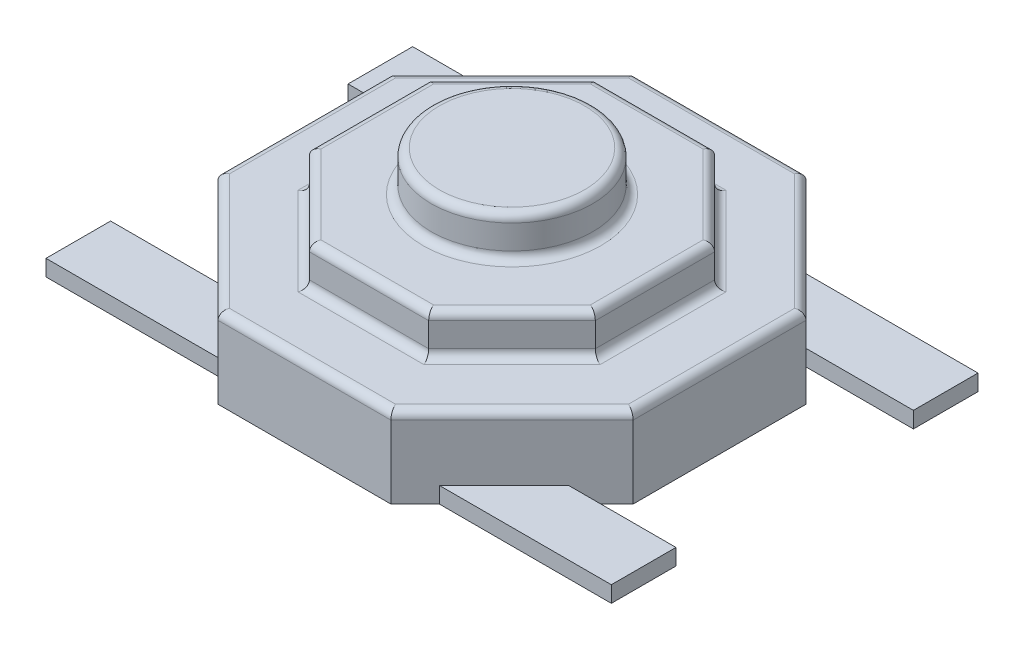
from build123d import *

# Parameters (mm, degrees)
BOSS_EXTRUDE1_DEPTH = 1
BOSS_EXTRUDE2_DEPTH = 0.5
SKETCH3_R           = 1
BOSS_EXTRUDE3_DEPTH = 0.5
FILLET1_R           = 0.1
SKETCH4_W           = 7
SKETCH4_H           = 0.8
BOSS_EXTRUDE4_DEPTH = 0.2
FILLET2_R           = 0.1


with BuildPart() as part:
    # Sketch1 → Boss-Extrude1 (new body)
    with BuildSketch(Plane(origin=(0, 0, 0), x_dir=(1, 0, 0), z_dir=(0, 1, 0))):
        Polygon((-1.07, 2.57), (-2.57, 1.07), (-2.57, -1.07), (-1.07, -2.57), (1.07, -2.57), (2.57, -1.07), (2.57, 1.07), (1.07, 2.57), align=None)
    extrude(amount=BOSS_EXTRUDE1_DEPTH)

    # Sketch2 → Boss-Extrude2 (add)
    with BuildSketch(Plane(origin=(0, 1, 0), x_dir=(1, 0, 0), z_dir=(0, 1, 0))):
        Polygon((-1.77, 0.73862915), (-1.77, -0.73862915), (-0.73862915, -1.77), (0.73862915, -1.77), (1.77, -0.73862915), (1.77, 0.73862915), (0.73862915, 1.77), (-0.73862915, 1.77), align=None)
    extrude(amount=BOSS_EXTRUDE2_DEPTH)

    # Sketch3 → Boss-Extrude3 (add)
    with BuildSketch(Plane(origin=(0, 1.5, 0), x_dir=(1, 0, 0), z_dir=(0, 1, 0))):
        with Locations(Location((0, 0, 0), (0, 0, 270))):
            Circle(SKETCH3_R)
    extrude(amount=BOSS_EXTRUDE3_DEPTH)

    # Fillet1
    fillet1_edges = [part.edges().sort_by_distance(p)[0] for p in [
        (0, 1, 2.57),
        (1.82, 1, 1.82),
        (2.57, 1, 0),
        (1.82, 1, -1.82),
        (-1.254314575, 1, -1.254314575),
        (-1.77, 1, 0),
        (-1.254314575, 1, 1.254314575),
        (0, 1, -2.57),
        (0, 1, 1.77),
        (1.254314575, 1, 1.254314575),
        (1.77, 1, 0),
        (1.254314575, 1, -1.254314575),
        (0, 1, -1.77),
        (-1.254314575, 1.5, -1.254314575),
        (-1.77, 1.5, 0),
        (-1.254314575, 1.5, 1.254314575),
        (0, 1.5, 1.77),
        (1.254314575, 1.5, 1.254314575),
        (1.77, 1.5, 0),
        (1.254314575, 1.5, -1.254314575),
        (-1.82, 1, -1.82),
        (0, 1.5, -1.77),
        (0, 1.5, -1),
        (-2.57, 1, 0),
        (-1.82, 1, 1.82),
    ]]
    fillet(fillet1_edges, radius=FILLET1_R)

    # Sketch4 → Boss-Extrude4 (add)
    with BuildSketch(Plane.XZ):
        with Locations((0, 1.87)):
            Rectangle(SKETCH4_W, SKETCH4_H)
        with Locations((0, -1.87)):
            Rectangle(SKETCH4_W, SKETCH4_H)
    extrude(amount=-BOSS_EXTRUDE4_DEPTH)

    # Fillet2
    fillet2_edges = [part.edges().sort_by_distance(p)[0] for p in [
        (0, 2, -1),
    ]]
    fillet(fillet2_edges, radius=FILLET2_R)


solid = part.part
